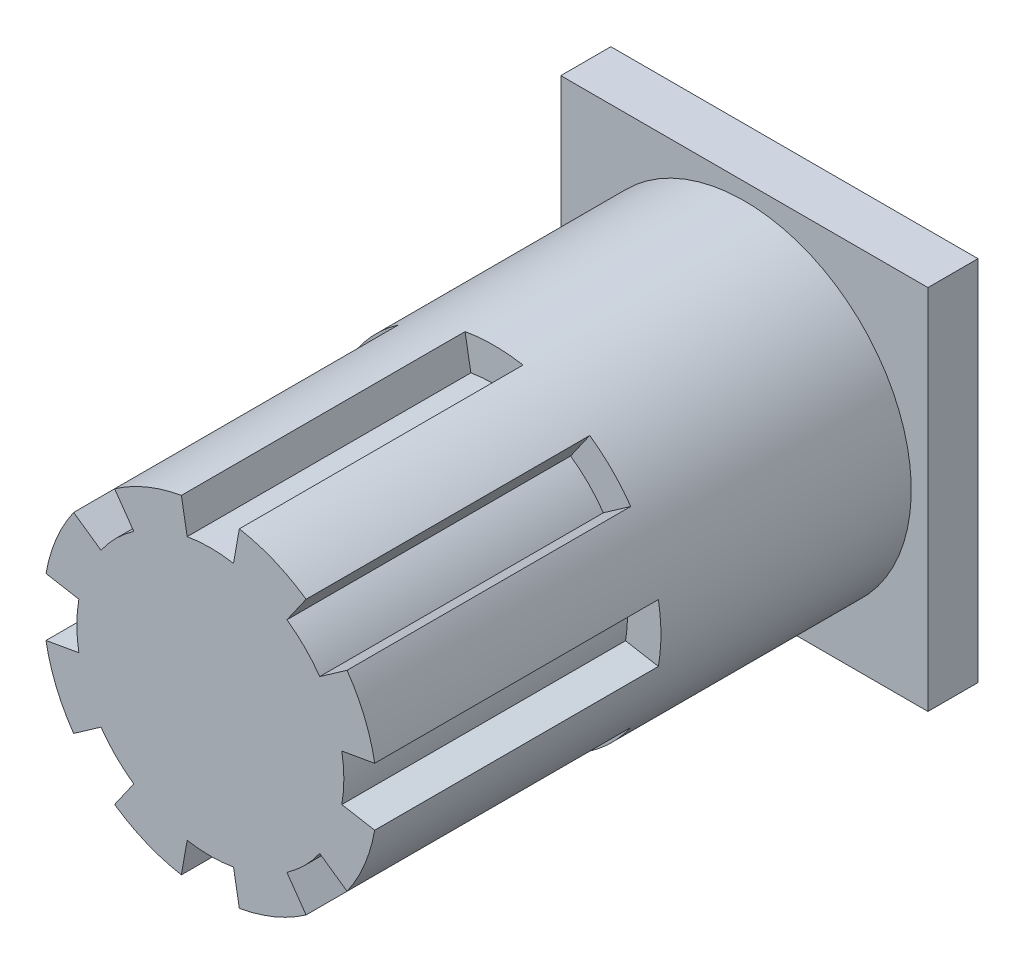
from build123d import *

# Parameters (mm, degrees)
SKETCH1_R           = 10
BOSS_EXTRUDE1_DEPTH = 20
CUT_EXTRUDE1_START  = -17
CUT_EXTRUDE1_DEPTH  = 17
CIRPATTERN1_COUNT   = 8
BOSS_EXTRUDE2_START = 12
SKETCH3_R           = 10
BOSS_EXTRUDE2_DEPTH = 12
SKETCH4_W           = 22
SKETCH4_H           = 22
BOSS_EXTRUDE3_DEPTH = 3


with BuildPart() as part:
    # Sketch1 → Boss-Extrude1 (new body)
    with BuildSketch(Plane.XY):
        Circle(SKETCH1_R)
    extrude(amount=BOSS_EXTRUDE1_DEPTH)

    # Sketch2 → Cut-Extrude1 (cut)
    with BuildSketch(Plane.XY.offset(20).offset(CUT_EXTRUDE1_START)):
        with BuildLine():
            Line((-1.736481777, 9.84807753), (-1.389185421, 7.878462024))
            ThreePointArc((-1.389185421, 7.878462024), (0, 8), (1.389185421, 7.878462024))
            Line((1.389185421, 7.878462024), (1.736481777, 9.84807753))
            ThreePointArc((1.736481777, 9.84807753), (0, 10), (-1.736481777, 9.84807753))
        make_face()
    cut_extrude1 = extrude(amount=CUT_EXTRUDE1_DEPTH, mode=Mode.SUBTRACT)

    # CirPattern1: Cut-Extrude1 ×8 about axis
    cirpattern1_axis = Axis((0, 0, 0), (0, 0, 1))
    for i in range(1, CIRPATTERN1_COUNT):
        add(cut_extrude1.rotate(cirpattern1_axis, i * 360 / CIRPATTERN1_COUNT), mode=Mode.SUBTRACT)

    # Sketch3 → Boss-Extrude2 (add)
    with BuildSketch(Plane(origin=(0, 0, 0), x_dir=(-1, 0, 0), z_dir=(0, 0, -1)).offset(BOSS_EXTRUDE2_START)):
        Circle(SKETCH3_R)
    extrude(amount=-BOSS_EXTRUDE2_DEPTH)

    # Sketch4 → Boss-Extrude3 (add)
    with BuildSketch(Plane(origin=(0, 0, -12), x_dir=(-1, 0, 0), z_dir=(0, 0, -1))):
        Rectangle(SKETCH4_W, SKETCH4_H)
    extrude(amount=BOSS_EXTRUDE3_DEPTH)


solid = part.part
